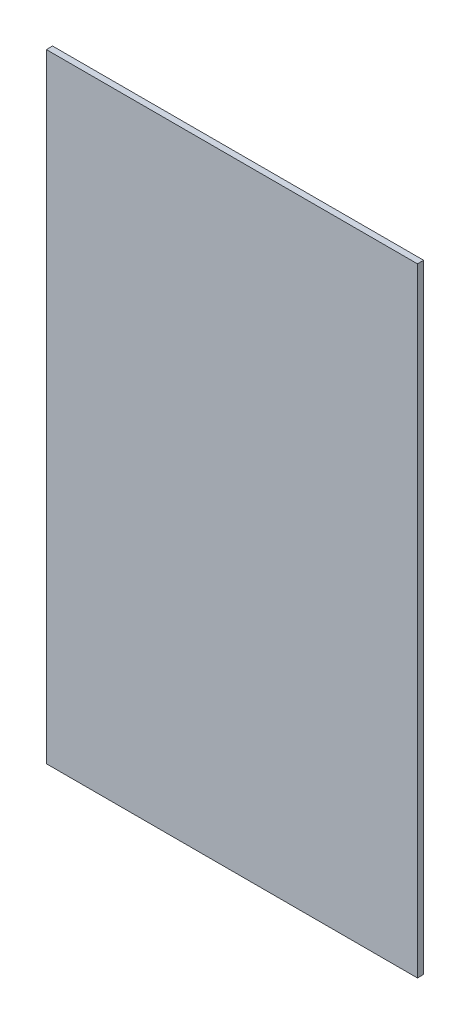
from build123d import *

# Parameters (mm, degrees)
SKETCH1_W           = 60
SKETCH1_H           = 100
BOSS_EXTRUDE1_DEPTH = 1


with BuildPart() as part:
    # Sketch1 → Boss-Extrude1 (new body)
    with BuildSketch(Plane.XY):
        with Locations((-0.962730401, -7.942583732)):
            Rectangle(SKETCH1_W, SKETCH1_H)
    extrude(amount=BOSS_EXTRUDE1_DEPTH)


solid = part.part
